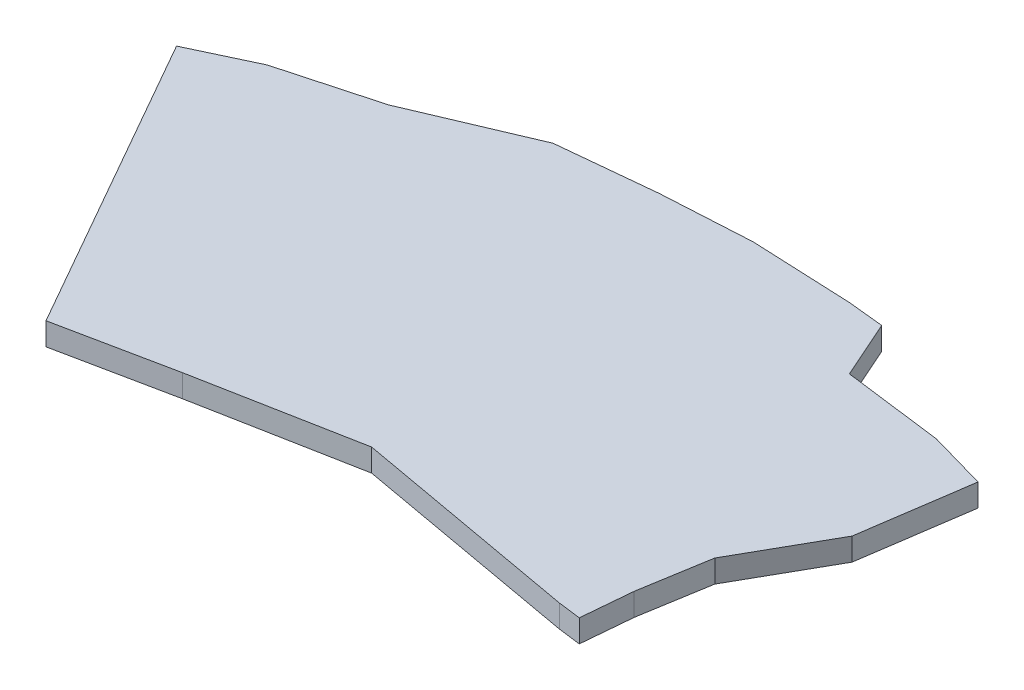
from build123d import *

# Parameters (mm, degrees)
BOSS_EXTRUDE1_DEPTH = 0.1
BOSS_EXTRUDE2_DEPTH = 0.4
BOSS_EXTRUDE3_DEPTH = 1.6
BOSS_EXTRUDE4_DEPTH = 1
BOSS_EXTRUDE6_DEPTH = 2
CUT_EXTRUDE1_DEPTH  = 0.1


with BuildPart() as part:
    # Sketch1 → Boss-Extrude1 (new body)
    with BuildSketch(Plane(origin=(0, 0, 0), x_dir=(1, 0, 0), z_dir=(0, 1, 0))):
        Polygon((-10.646042249, 26.02895066), (-5.401733978, 7.546949539), (-3.551765124, 4.298091631), (5.209504113, 6.784120954), (-1.025832553, 28.758706218), align=None)
    extrude(amount=BOSS_EXTRUDE1_DEPTH)



with BuildPart() as body_2:
    # Sketch1<4> → Boss-Extrude2 (new body)
    with BuildSketch(Plane(origin=(0, 0, 0), x_dir=(1, 0, 0), z_dir=(0, 1, 0))):
        Polygon((17.758145427, 34.528733828), (7.855406085, 33.137420227), (11.036175402, 10.498146498), (20.938914744, 11.889460098), align=None)
    extrude(amount=-BOSS_EXTRUDE2_DEPTH)


with BuildPart() as body_3:
    # Sketch1<6> → Boss-Extrude3 (new body)
    with BuildSketch(Plane(origin=(0, 0, 0), x_dir=(1, 0, 0), z_dir=(0, 1, 0))):
        Polygon((34.161951749, 34.390264264), (24.172089788, 34.840439781), (23.15739477, 12.323304181), (33.147256731, 11.873128664), align=None)
    extrude(amount=-BOSS_EXTRUDE3_DEPTH)


with BuildPart() as body_4:
    # Sketch1<7> → Boss-Extrude4 (new body)
    with BuildSketch(Plane(origin=(0, 0, 0), x_dir=(1, 0, 0), z_dir=(0, 1, 0))):
        Polygon((48.175095059, 27.256571334), (38.325120534, 28.98226014), (34.416396618, 6.671846549), (44.266371143, 4.946157743), align=None)
    extrude(amount=-BOSS_EXTRUDE4_DEPTH)


with BuildPart() as part_1:
    add(part.part)

    add(body_2.part)  # Boss-Extrude6 merges body 2

    add(body_3.part)  # Boss-Extrude6 merges body 3

    add(body_4.part)  # Boss-Extrude6 merges body 4
    # Sketch1<9> → Boss-Extrude6 (add)
    with BuildSketch(Plane(origin=(0, 0, 0), x_dir=(1, 0, 0), z_dir=(0, 1, 0))):
        Polygon((-10.796366677, 29.172241213), (-16.256074113, 26.609004932), (-0.986799702, -0.206421066), (9.037125491, 1.85322051), (23.089608754, 4.521255887), (43.361671586, 0.876173274), (45.356947793, 0.620078516), (45.754807654, 5.085280828), (46.768236946, 11.196430212), (51.159441766, 18.953851746), (52.586728994, 28.662836734), (47.446591859, 30.124478905), (38.61884098, 31.25680776), (36.335094453, 36.39348437), (33.214867012, 36.720672561), (24.24680656, 37.115536931), (16.382403353, 36.668127405), (7.84022621, 35.816299809), (-2.37484271, 31.479114004), align=None)
    extrude(amount=BOSS_EXTRUDE6_DEPTH)

    # Sketch1<11> → Cut-Extrude1 (cut)
    with BuildSketch(Plane(origin=(0, 0, 0), x_dir=(1, 0, 0), z_dir=(0, 1, 0))):
        Polygon((-10.646042249, 26.02895066), (-5.401733978, 7.546949539), (-3.551765124, 4.298091631), (5.209504113, 6.784120954), (-1.025832553, 28.758706218), align=None)
    extrude(amount=CUT_EXTRUDE1_DEPTH, mode=Mode.SUBTRACT)


solid = part_1.part
